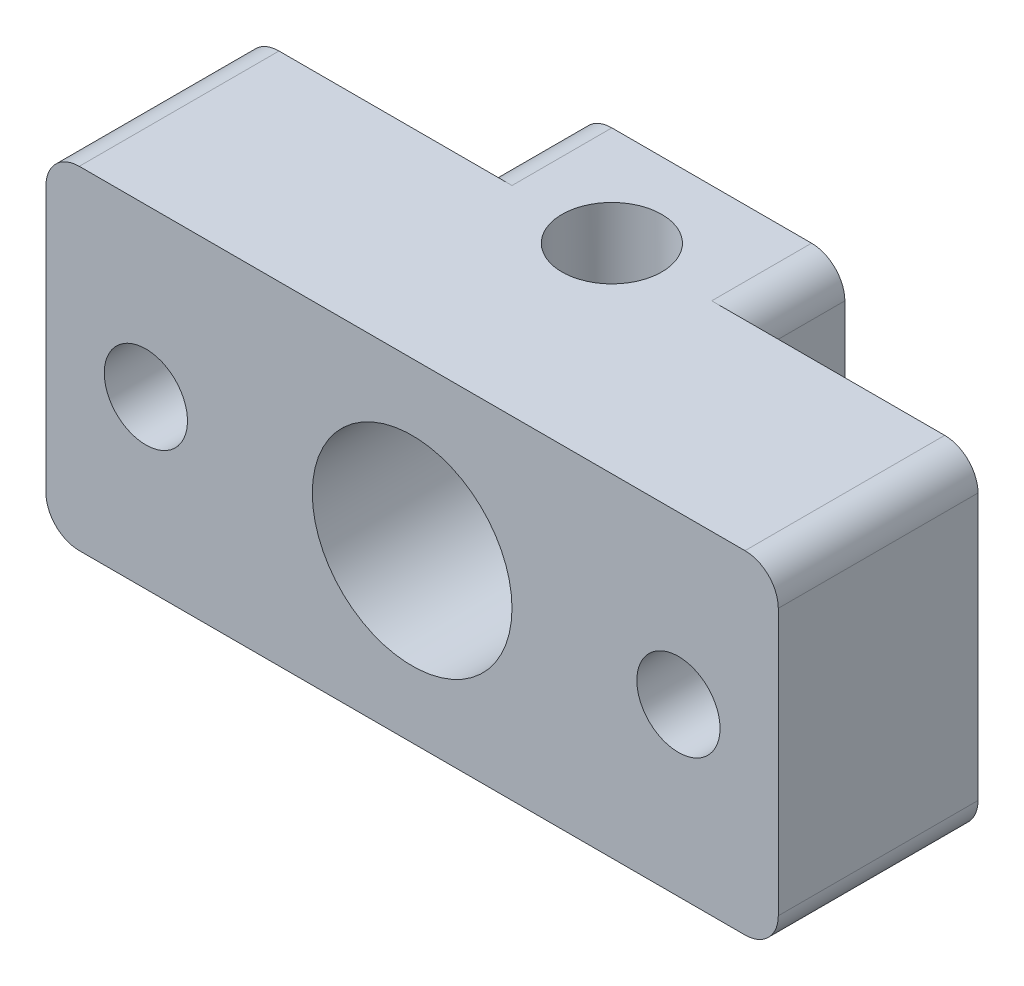
from build123d import *

# Parameters (mm, degrees)
SKETCH_1_W          = 22
SKETCH_1_H          = 10
SKETCH_1_R          = 1.25
SKETCH_1_R_2        = 3
EXTRUDE_1_DEPTH     = 9
SKETCH_2_R          = 1.5
CUT_EXTRUDE_1_DEPTH = 11
SKETCH_4_W          = 7
SKETCH_4_H          = 3
CUT_EXTRUDE_2_DEPTH = 10
FILLET_1_R          = 1


with BuildPart() as part:
    # 草图1 → 凸台-拉伸1 (new body)
    with BuildSketch(Plane.XY):
        Rectangle(SKETCH_1_W, SKETCH_1_H)
        with Locations((8, 0)):
            Circle(SKETCH_1_R, mode=Mode.SUBTRACT)
        with Locations(Location((-8, 0, 0), (0, 0, 180))):
            Circle(SKETCH_1_R, mode=Mode.SUBTRACT)
        Circle(SKETCH_1_R_2, mode=Mode.SUBTRACT)
    extrude(amount=EXTRUDE_1_DEPTH)

    # 草图2 → 切除-拉伸1 (cut)
    with BuildSketch(Plane.XZ.offset(5)):
        with Locations(Location((0, 3, 0), (0, 0, 270))):
            Circle(SKETCH_2_R)
    extrude(amount=-CUT_EXTRUDE_1_DEPTH, mode=Mode.SUBTRACT)

    # 草图4 → 切除-拉伸2 (cut)
    with BuildSketch(Plane.XZ.offset(5)):
        with Locations((-7.5, 1.5)):
            Rectangle(SKETCH_4_W, SKETCH_4_H)
        with Locations((7.5, 1.5)):
            Rectangle(SKETCH_4_W, SKETCH_4_H)
    extrude(amount=-CUT_EXTRUDE_2_DEPTH, mode=Mode.SUBTRACT)

    # 圆角1
    fillet_1_edges = [part.edges().sort_by_distance(p)[0] for p in [
        (-4, 5, 1.5),
        (-4, -5, 1.5),
        (4, 5, 1.5),
        (4, -5, 1.5),
        (11, -5, 6),
        (-11, -5, 6),
        (-11, 5, 6),
        (11, 5, 6),
    ]]
    fillet(fillet_1_edges, radius=FILLET_1_R)


solid = part.part
